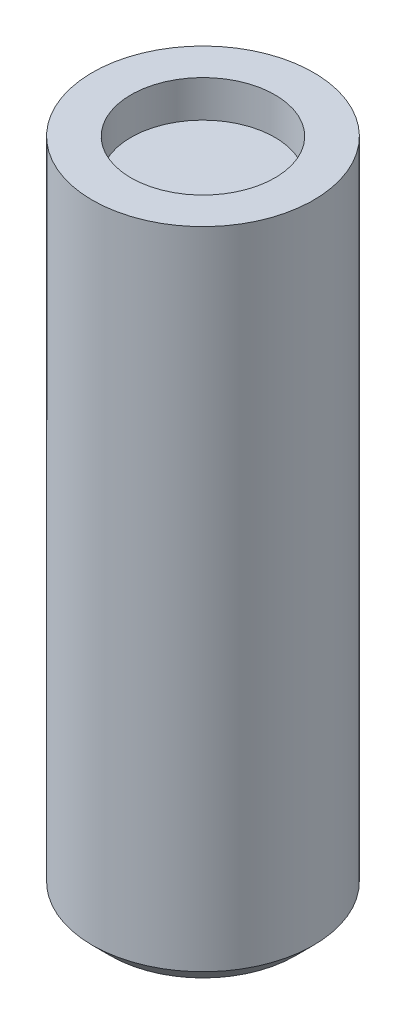
from build123d import *

# Parameters (mm, degrees)
SKETCH1_R           = 0.6
BOSS_EXTRUDE1_DEPTH = 3.6
CHAMFER1_SIZE       = 0.1
SKETCH2_R           = 0.390493672
CUT_EXTRUDE1_DEPTH  = 0.2


with BuildPart() as part:
    # Sketch1 → Boss-Extrude1 (new body)
    with BuildSketch(Plane(origin=(0, 0, 0), x_dir=(1, 0, 0), z_dir=(0, 1, 0))):
        with Locations(Location((0, 0, 0), (0, 0, 270))):
            Circle(SKETCH1_R)
    extrude(amount=BOSS_EXTRUDE1_DEPTH)

    # Chamfer1
    chamfer1_edges = [part.edges().sort_by_distance(p)[0] for p in [
        (0, 0, -0.6),
    ]]
    chamfer(chamfer1_edges, length=CHAMFER1_SIZE)

    # Sketch2 → Cut-Extrude1 (cut)
    with BuildSketch(Plane(origin=(0, 3.6, 0), x_dir=(1, 0, 0), z_dir=(0, 1, 0))):
        with Locations(Location((0, 0, 0), (0, 0, 270))):
            Circle(SKETCH2_R)
    extrude(amount=-CUT_EXTRUDE1_DEPTH, mode=Mode.SUBTRACT)


solid = part.part
